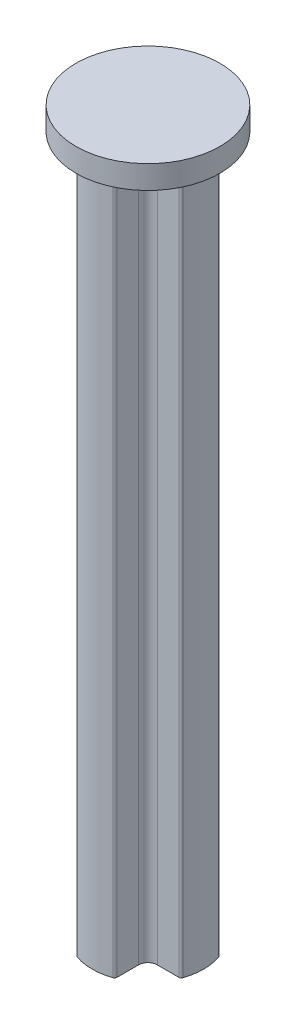
from build123d import *

# Parameters (mm, degrees)
SKETCH2_R           = 3.1
BOSS_EXTRUDE1_DEPTH = 31
SKETCH3_R           = 3.1
CUT_EXTRUDE1_DEPTH  = 30


with BuildPart() as part:
    # Sketch2 → Boss-Extrude1 (new body)
    with BuildSketch(Plane(origin=(0, 0, 0), x_dir=(1, 0, 0), z_dir=(0, 1, 0))):
        with Locations(Location((0, 0, 0), (0, 0, 270))):
            Circle(SKETCH2_R)
    extrude(amount=BOSS_EXTRUDE1_DEPTH)

    # Sketch3 → Cut-Extrude1 (cut)
    with BuildSketch(Plane(origin=(0, 0, 0), x_dir=(1, 0, 0), z_dir=(0, 1, 0))):
        with Locations(Location((0, 0, 0), (0, 0, 270))):
            Circle(SKETCH3_R)
        with BuildLine():
            Line((-0.84, -1.24), (-0.84, -2.177705214))
            ThreePointArc((-0.84, -2.177705214), (-0.821293884, -2.235940121), (-0.772173913, -2.27238805))
            ThreePointArc((-0.772173913, -2.27238805), (0, -2.4), (0.772173913, -2.27238805))
            ThreePointArc((0.772173913, -2.27238805), (0.821293884, -2.235940121), (0.84, -2.177705214))
            Line((0.84, -2.177705214), (0.84, -1.24))
            ThreePointArc((0.84, -1.24), (0.957157288, -0.957157288), (1.24, -0.84))
            Line((1.24, -0.84), (2.177705214, -0.84))
            ThreePointArc((2.177705214, -0.84), (2.235940121, -0.821293884), (2.27238805, -0.772173913))
            ThreePointArc((2.27238805, -0.772173913), (2.4, 0), (2.27238805, 0.772173913))
            ThreePointArc((2.27238805, 0.772173913), (2.235940121, 0.821293884), (2.177705214, 0.84))
            Line((2.177705214, 0.84), (1.24, 0.84))
            ThreePointArc((1.24, 0.84), (0.957157288, 0.957157288), (0.84, 1.24))
            Line((0.84, 1.24), (0.84, 2.177705214))
            ThreePointArc((0.84, 2.177705214), (0.821293884, 2.235940121), (0.772173913, 2.27238805))
            ThreePointArc((0.772173913, 2.27238805), (0, 2.4), (-0.772173913, 2.27238805))
            ThreePointArc((-0.772173913, 2.27238805), (-0.821293884, 2.235940121), (-0.84, 2.177705214))
            Line((-0.84, 2.177705214), (-0.84, 1.24))
            ThreePointArc((-0.84, 1.24), (-0.957157288, 0.957157288), (-1.24, 0.84))
            Line((-1.24, 0.84), (-2.177705214, 0.84))
            ThreePointArc((-2.177705214, 0.84), (-2.235940121, 0.821293884), (-2.27238805, 0.772173913))
            ThreePointArc((-2.27238805, 0.772173913), (-2.4, 0), (-2.27238805, -0.772173913))
            ThreePointArc((-2.27238805, -0.772173913), (-2.235940121, -0.821293884), (-2.177705214, -0.84))
            Line((-2.177705214, -0.84), (-1.24, -0.84))
            ThreePointArc((-1.24, -0.84), (-0.957157288, -0.957157288), (-0.84, -1.24))
        make_face(mode=Mode.SUBTRACT)
    extrude(amount=CUT_EXTRUDE1_DEPTH, mode=Mode.SUBTRACT)


solid = part.part
